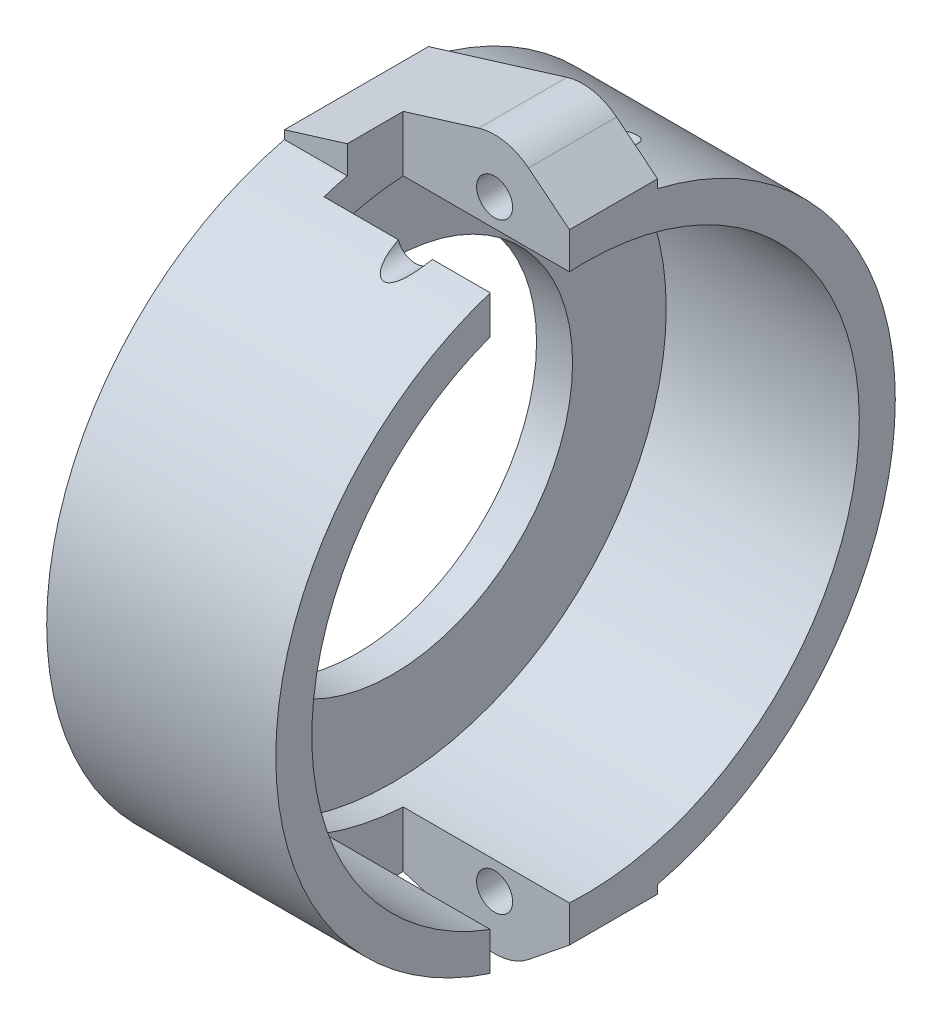
from build123d import *

# Parameters (mm, degrees)
BOSS_EXTRUDE1_DEPTH     = 10
SKETCH4_R               = 2.5
CUT_EXTRUDE1_DEPTH      = 73.697811944
CUT_EXTRUDE2_REACH      = 109.281
CUT_EXTRUDE2_END_RADIUS = 38
SKETCH5_W               = 23.074324902
SKETCH5_H               = 11


with BuildPart() as part:
    # Sketch1 → Revolve1 (revolve)
    with BuildSketch(Plane.XY):
        Polygon((5, -38), (5, -25), (0, -25), (0, -43), (31.8, -43), (31.8, -38), align=None)
    revolve(axis=Axis((96.017453448, 0, 0), (-1, 0, 0)))

    # Sketch3 → Boss-Extrude1 (add, symmetric)
    with BuildSketch(Plane.XY):
        with BuildLine():
            Line((31.8, -43), (26.114355816, -47.581512833))
            ThreePointArc((26.114355816, -47.581512833), (22.82386933, -49.10680541), (19.202406183, -48.909768758))
            Line((19.202406183, -48.909768758), (0, -43))
            Line((0, -43), (0, -38))
            Line((0, -38), (31.8, -38))
            Line((31.8, -38), (31.8, -43))
        make_face()
    boss_extrude1 = extrude(amount=BOSS_EXTRUDE1_DEPTH, both=True)

    # Sketch4 → Cut-Extrude1 (cut, symmetric)
    with BuildSketch(Plane.XY):
        with Locations((21.408505666, -41.741566399)):
            Circle(SKETCH4_R)
    cut_extrude1 = extrude(amount=CUT_EXTRUDE1_DEPTH, both=True, mode=Mode.SUBTRACT)

    # Cut-Extrude2: up to this cylinder (the profile starts outside it)
    cut_extrude2_end = Plane(origin=(20.262838, 0, 0), z_dir=(1, 0, 0)) * Cylinder(CUT_EXTRUDE2_END_RADIUS, 295.562, mode=Mode.PRIVATE)
    # Sketch5 → Cut-Extrude2 (cut, up to the surface)
    with BuildSketch(Plane(origin=(0, -50, 0), x_dir=(1, 0, 0), z_dir=(0, 1, 0)), mode=Mode.PRIVATE) as cut_extrude2_sk1:
        with Locations((20.262837549, -7.731366933)):
            Rectangle(SKETCH5_W, SKETCH5_H)
    cut_extrude2_tool1 = extrude(cut_extrude2_sk1.sketch, amount=CUT_EXTRUDE2_REACH, mode=Mode.PRIVATE) - cut_extrude2_end
    cut_extrude2 = cut_extrude2_tool1.solids().sort_by_distance((20.262838, -50, 7.731367))[0]
    add(cut_extrude2, mode=Mode.SUBTRACT)

    # Mirror1: Boss-Extrude1, Cut-Extrude1, Cut-Extrude2 across plane
    add(boss_extrude1.mirror(Plane.ZX))
    add(cut_extrude1.mirror(Plane.ZX), mode=Mode.SUBTRACT)
    add(cut_extrude2.mirror(Plane.ZX), mode=Mode.SUBTRACT)


solid = part.part
